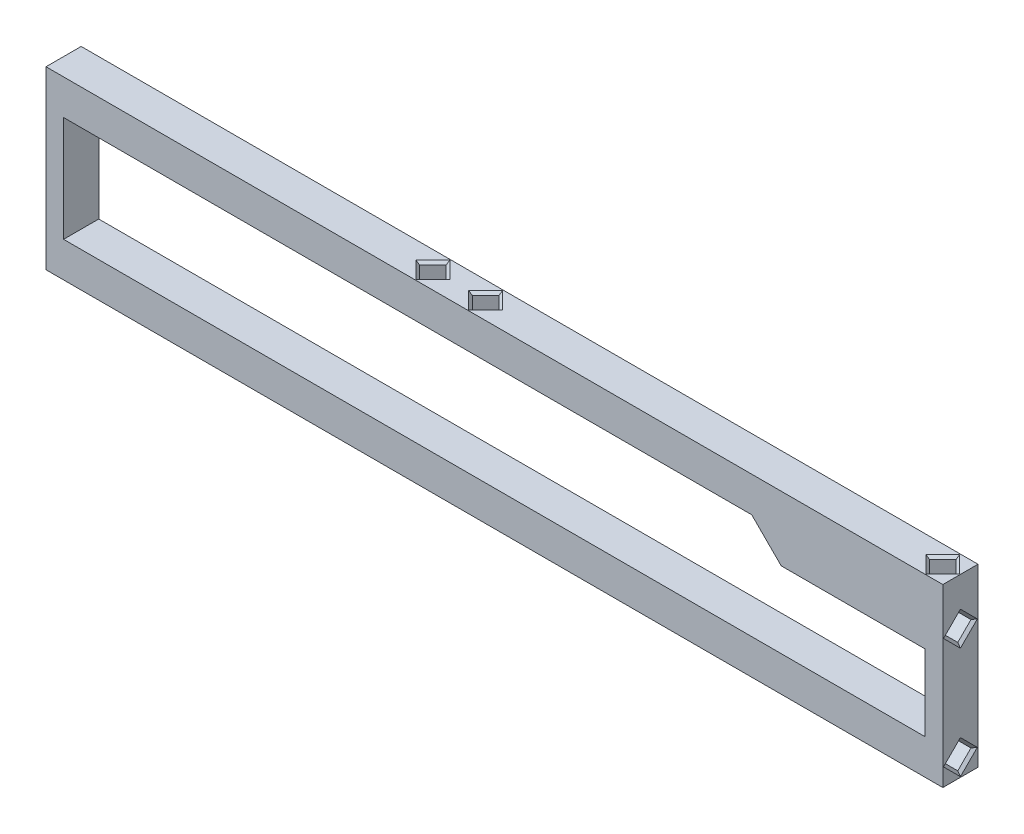
from build123d import *

# Parameters (mm, degrees)
SKETCH1_W           = 215.9
SKETCH1_H           = 42.333333334
BOSS_EXTRUDE1_DEPTH = 8.466666667
REAR_PIN_DEPTH      = 6.35
FRONT_PIN_DEPTH     = 6.35
TOP_PINS_DEPTH      = 6.35
PIN_CHAMFER_SIZE    = 0.635


with BuildPart() as part:
    # Sketch1 → Boss-Extrude1 (new body)
    with BuildSketch(Plane.XY):
        Rectangle(SKETCH1_W, SKETCH1_H)
        Polygon((-103.716666667, -12.7), (103.716666667, -12.7), (103.716666667, 5.604933333), (69.045666667, 5.604933333), (61.9506, 12.7), (-103.716666667, 12.7), align=None, mode=Mode.SUBTRACT)
    extrude(amount=BOSS_EXTRUDE1_DEPTH)

    # Sketch3 → rear pin (cut)
    with BuildSketch(Plane(origin=(-107.95, 0, 91.206646131), x_dir=(0, 0, -1), z_dir=(1, 0, 0))):
        Polygon((83.798312798, 16.933333333), (86.973312798, 20.108333333), (90.148312798, 16.933333333), (86.973312798, 13.758333333), align=None)
        Polygon((86.973312798, -20.108333333), (83.798312798, -16.933333333), (86.973312798, -13.758333333), (90.148312798, -16.933333333), align=None)
    extrude(amount=REAR_PIN_DEPTH, mode=Mode.SUBTRACT)

    # Sketch4 → front pin (cut)
    with BuildSketch(Plane(origin=(107.95, 0, 0), x_dir=(0, 0, -1), z_dir=(1, 0, 0))):
        Polygon((-1.058333333, 9.838266667), (-4.233333333, 13.013266667), (-7.408333333, 9.838266667), (-4.233333333, 6.663266667), align=None)
        Polygon((-1.058333333, -16.933333333), (-4.233333333, -13.758333333), (-7.408333333, -16.933333333), (-4.233333333, -20.108333333), align=None)
    extrude(amount=-FRONT_PIN_DEPTH, mode=Mode.SUBTRACT)

    # Sketch5 → top pins (cut)
    with BuildSketch(Plane(origin=(0, 21.166666667, 0), x_dir=(1, 0, 0), z_dir=(0, 1, 0))):
        Polygon((106.891666667, -4.233333333), (103.716666667, -7.408333333), (100.541666667, -4.233333333), (103.716666667, -1.058333333), align=None)
        Polygon((-3.175000085, -4.233333333), (-6.350000085, -7.408333333), (-9.525000085, -4.233333333), (-6.350000085, -1.058333333), align=None)
        Polygon((-15.875000085, -4.233333333), (-19.050000085, -7.408333333), (-22.225000085, -4.233333333), (-19.050000085, -1.058333333), align=None)
    extrude(amount=-TOP_PINS_DEPTH, mode=Mode.SUBTRACT)

    # pin chamfer
    pin_chamfer_edges = [part.edges().sort_by_distance(p)[0] for p in [
        (-4.762500085, 14.816666667, 2.645833333),
        (-4.762500085, 14.816666667, 5.820833333),
        (-7.937500085, 14.816666667, 5.820833333),
        (-7.937500085, 14.816666667, 2.645833333),
        (-4.762500085, 21.166666667, 2.645833333),
        (-7.937500085, 21.166666667, 2.645833333),
        (-7.937500085, 21.166666667, 5.820833333),
        (-4.762500085, 21.166666667, 5.820833333),
        (-17.462500085, 14.816666667, 2.645833333),
        (-17.462500085, 14.816666667, 5.820833333),
        (-20.637500085, 14.816666667, 5.820833333),
        (-20.637500085, 14.816666667, 2.645833333),
        (-17.462500085, 21.166666667, 2.645833333),
        (-20.637500085, 21.166666667, 2.645833333),
        (-20.637500085, 21.166666667, 5.820833333),
        (-17.462500085, 21.166666667, 5.820833333),
        (-107.95, 15.345833333, 5.820833333),
        (-107.95, 15.345833333, 2.645833333),
        (-107.95, 18.520833333, 2.645833333),
        (-107.95, 18.520833333, 5.820833333),
        (-101.6, 15.345833333, 5.820833333),
        (-101.6, 15.345833333, 2.645833333),
        (-101.6, 18.520833333, 2.645833333),
        (-101.6, 18.520833333, 5.820833333),
        (-107.95, -18.520833333, 2.645833333),
        (-107.95, -15.345833333, 2.645833333),
        (-107.95, -15.345833333, 5.820833333),
        (-107.95, -18.520833333, 5.820833333),
        (-101.6, -18.520833333, 2.645833333),
        (-101.6, -15.345833333, 2.645833333),
        (-101.6, -15.345833333, 5.820833333),
        (-101.6, -18.520833333, 5.820833333),
        (101.6, 8.250766667, 2.645833333),
        (101.6, 8.250766667, 5.820833333),
        (101.6, 11.425766667, 5.820833333),
        (101.6, 11.425766667, 2.645833333),
        (107.95, 8.250766667, 2.645833333),
        (107.95, 11.425766667, 2.645833333),
        (107.95, 11.425766667, 5.820833333),
        (107.95, 8.250766667, 5.820833333),
        (101.6, -18.520833333, 2.645833333),
        (101.6, -18.520833333, 5.820833333),
        (101.6, -15.345833333, 5.820833333),
        (101.6, -15.345833333, 2.645833333),
        (107.95, -18.520833333, 2.645833333),
        (107.95, -15.345833333, 2.645833333),
        (107.95, -15.345833333, 5.820833333),
        (107.95, -18.520833333, 5.820833333),
        (105.304166667, 14.816666667, 2.645833333),
        (105.304166667, 14.816666667, 5.820833333),
        (102.129166667, 14.816666667, 5.820833333),
        (102.129166667, 14.816666667, 2.645833333),
        (105.304166667, 21.166666667, 2.645833333),
        (102.129166667, 21.166666667, 2.645833333),
        (102.129166667, 21.166666667, 5.820833333),
        (105.304166667, 21.166666667, 5.820833333),
    ]]
    chamfer(pin_chamfer_edges, length=PIN_CHAMFER_SIZE)


solid = part.part
